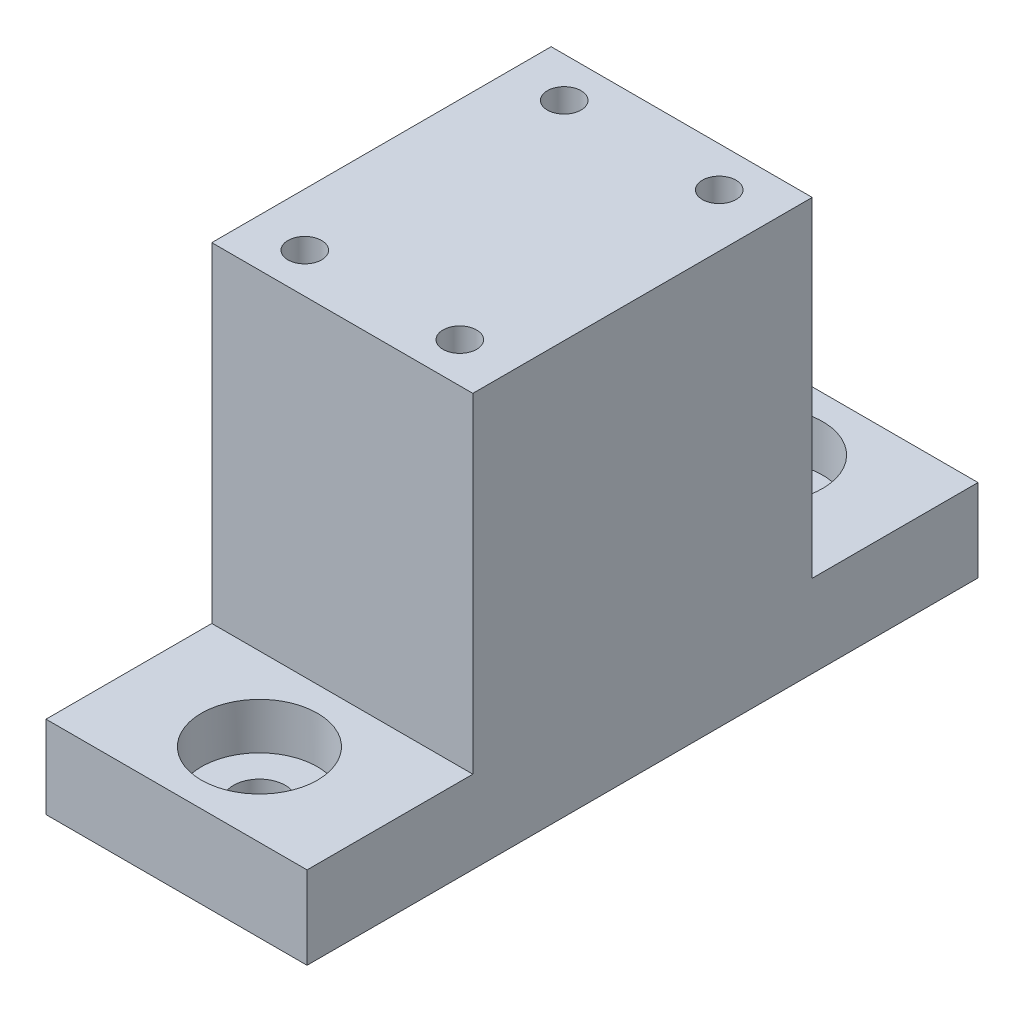
from build123d import *

# Parameters (mm, degrees)
BOSS_EXTRUDE1_DEPTH = 39.99992
SKETCH2_R           = 2.5796875
CUT_EXTRUDE1_DEPTH  = 91.750134452
CUT_EXTRUDE2_START  = -6.35
SKETCH2_3_R         = 4.7625
SKETCH2_3_R_2       = 2.5796875
CUT_EXTRUDE2_DEPTH  = 56.8452
SKETCH3_R           = 3.96875
CUT_EXTRUDE3_DEPTH  = 83.435235239
SKETCH3_5_R         = 8.89
SKETCH3_5_R_2       = 3.96875
CUT_EXTRUDE4_DEPTH  = 7.10438


with BuildPart() as part:
    # Sketch1 → Boss-Extrude1 (new body)
    with BuildSketch(Plane(origin=(0, 0, 0), x_dir=(0, 0, -1), z_dir=(1, 0, 0))):
        Polygon((51.4, 0), (-51.4, 0), (-51.4, 12.6619), (-26, 12.6619), (-26, 63.1952), (26, 63.1952), (26, 12.6619), (51.4, 12.6619), align=None)
    extrude(amount=BOSS_EXTRUDE1_DEPTH)

    # Sketch2 → Cut-Extrude1 (cut, through all)
    with BuildSketch(Plane(origin=(0, 63.1952, 0), x_dir=(1, 0, 0), z_dir=(0, 1, 0))):
        with Locations(Location((8.12496, 19.875, 0), (0, 0, 270))):
            Circle(SKETCH2_R)
        with Locations(Location((31.87496, 19.875, 0), (0, 0, 270))):
            Circle(SKETCH2_R)
        with Locations(Location((8.12496, -19.875, 0), (0, 0, 270))):
            Circle(SKETCH2_R)
        with Locations(Location((31.87496, -19.875, 0), (0, 0, 270))):
            Circle(SKETCH2_R)
    extrude(amount=-CUT_EXTRUDE1_DEPTH, mode=Mode.SUBTRACT)

    # Sketch2<3> → Cut-Extrude2 (cut)
    # profile 1 of 4: a face of its own
    with BuildSketch(Plane(origin=(0, 63.1952, 0), x_dir=(1, 0, 0), z_dir=(0, 1, 0)).offset(CUT_EXTRUDE2_START)):
        with Locations(Location((8.12496, 19.875, 0), (0, 0, 90))):
            Circle(SKETCH2_3_R)
        with Locations(Location((8.12496, 19.875, 0), (0, 0, 270))):
            Circle(SKETCH2_3_R_2, mode=Mode.SUBTRACT)
    # profile 2 of 4: a face of its own
    with BuildSketch(Plane(origin=(0, 63.1952, 0), x_dir=(1, 0, 0), z_dir=(0, 1, 0)).offset(CUT_EXTRUDE2_START)):
        with Locations(Location((31.87496, 19.875, 0), (0, 0, 90))):
            Circle(SKETCH2_3_R)
        with Locations(Location((31.87496, 19.875, 0), (0, 0, 270))):
            Circle(SKETCH2_3_R_2, mode=Mode.SUBTRACT)
    # profile 3 of 4: a face of its own
    with BuildSketch(Plane(origin=(0, 63.1952, 0), x_dir=(1, 0, 0), z_dir=(0, 1, 0)).offset(CUT_EXTRUDE2_START)):
        with Locations(Location((8.12496, -19.875, 0), (0, 0, 90))):
            Circle(SKETCH2_3_R)
        with Locations(Location((8.12496, -19.875, 0), (0, 0, 270))):
            Circle(SKETCH2_3_R_2, mode=Mode.SUBTRACT)
    # profile 4 of 4: a face of its own
    with BuildSketch(Plane(origin=(0, 63.1952, 0), x_dir=(1, 0, 0), z_dir=(0, 1, 0)).offset(CUT_EXTRUDE2_START)):
        with Locations(Location((31.87496, -19.875, 0), (0, 0, 90))):
            Circle(SKETCH2_3_R)
        with Locations(Location((31.87496, -19.875, 0), (0, 0, 270))):
            Circle(SKETCH2_3_R_2, mode=Mode.SUBTRACT)
    extrude(amount=-CUT_EXTRUDE2_DEPTH, mode=Mode.SUBTRACT)

    # Sketch3 → Cut-Extrude3 (cut, through all)
    with BuildSketch(Plane(origin=(0, 12.6619, 0), x_dir=(1, 0, 0), z_dir=(0, 1, 0))):
        with Locations(Location((19.99996, 38.7, 0), (0, 0, 270))):
            Circle(SKETCH3_R)
        with Locations(Location((19.99996, -38.7, 0), (0, 0, 90))):
            Circle(SKETCH3_R)
    extrude(amount=-CUT_EXTRUDE3_DEPTH, mode=Mode.SUBTRACT)

    # Sketch3<5> → Cut-Extrude4 (cut)
    # profile 1 of 2: a face of its own
    with BuildSketch(Plane(origin=(0, 12.6619, 0), x_dir=(1, 0, 0), z_dir=(0, 1, 0))):
        with Locations(Location((19.99996, 38.7, 0), (0, 0, 270))):
            Circle(SKETCH3_5_R)
        with Locations(Location((19.99996, 38.7, 0), (0, 0, 270))):
            Circle(SKETCH3_5_R_2, mode=Mode.SUBTRACT)
    # profile 2 of 2: a face of its own
    with BuildSketch(Plane(origin=(0, 12.6619, 0), x_dir=(1, 0, 0), z_dir=(0, 1, 0))):
        with Locations(Location((19.99996, -38.7, 0), (0, 0, 270))):
            Circle(SKETCH3_5_R)
        with Locations(Location((19.99996, -38.7, 0), (0, 0, 270))):
            Circle(SKETCH3_5_R_2, mode=Mode.SUBTRACT)
    extrude(amount=-CUT_EXTRUDE4_DEPTH, mode=Mode.SUBTRACT)


solid = part.part
